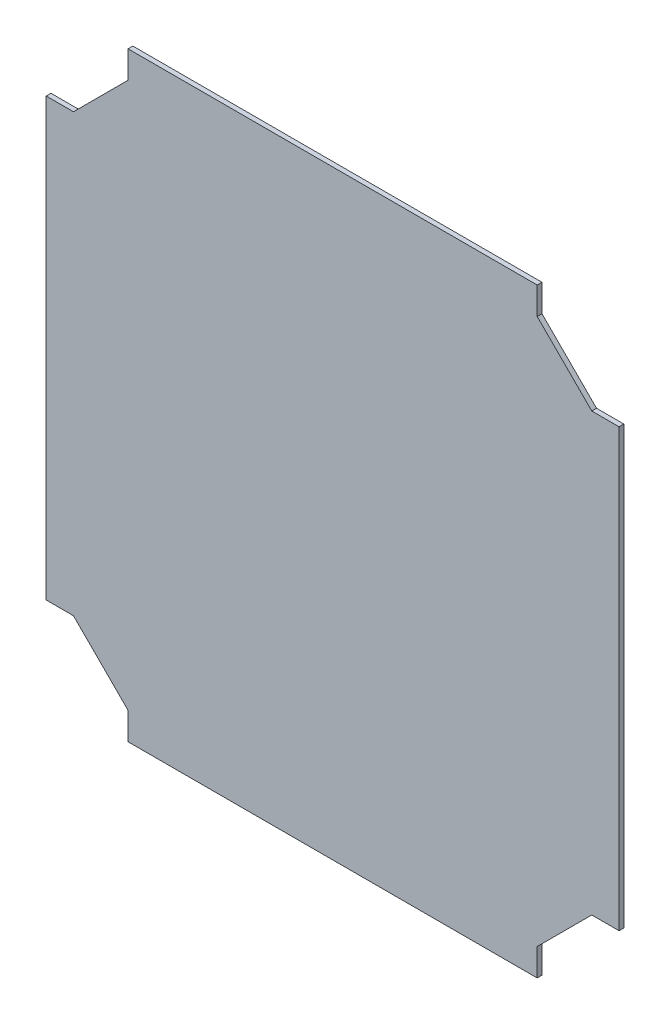
from build123d import *

# Parameters (mm, degrees)
BOSS_EXTRUDE2_DEPTH = 3.5


with BuildPart() as part:
    # Sketch2 → Boss-Extrude2 (new body)
    with BuildSketch(Plane.XY):
        Polygon((-74.446848513, 440), (225.553151486, 440), (225.553151486, 420.000000001), (265.553151487, 380), (285.553151487, 380), (285.553151487, 60), (265.553151487, 60), (225.553151487, 20), (225.553151487, 0), (0, 0), (-74.446848513, 0), (-74.446848513, 20), (-114.446848513, 60), (-134.446848513, 60), (-134.446848513, 380), (-114.446848513, 380), (-74.446848513, 420), align=None)
    extrude(amount=BOSS_EXTRUDE2_DEPTH)


solid = part.part
